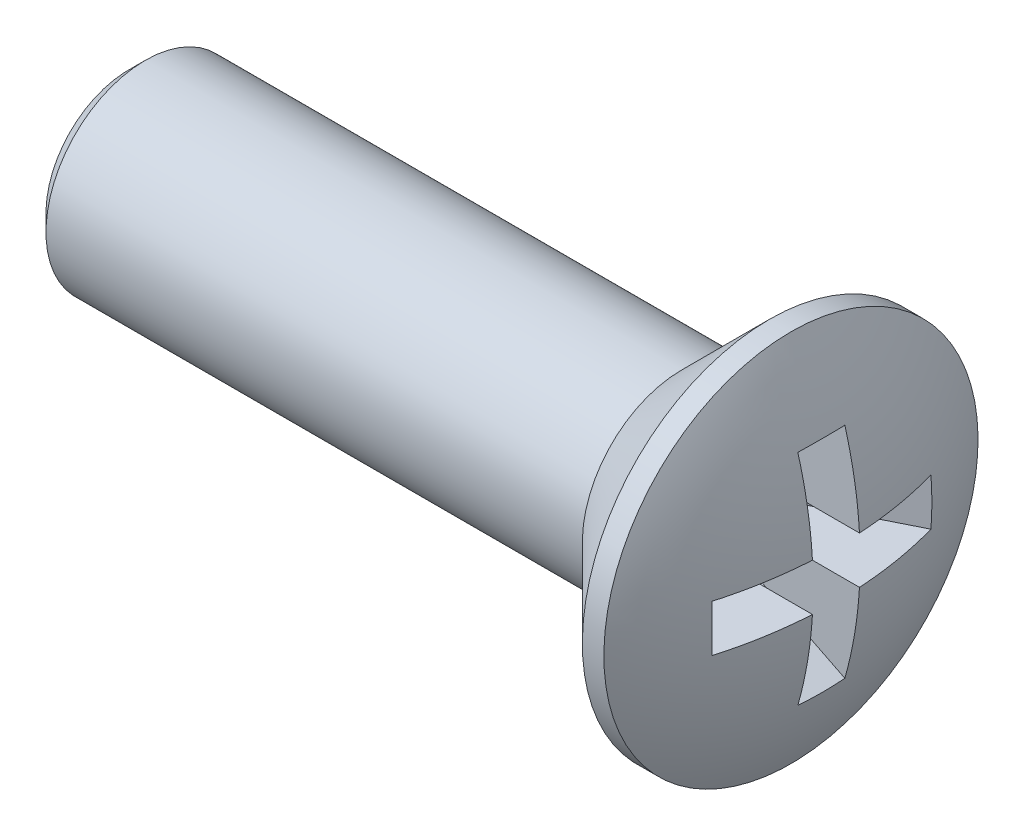
from build123d import *

# Parameters (mm, degrees)
SKETCH2_W          = 1.42
SKETCH2_H          = 2.84
SKETCH2_W_2        = 2.84
SKETCH2_H_2        = 1.42
CUT_EXTRUDE1_DEPTH = 3.85
DRAFT1_ANGLE       = 26.5
CHAMFER1_SIZE      = 0.5


with BuildPart() as part:
    # Sketch1 → Revolve1 (revolve)
    with BuildSketch(Plane.XY):
        with BuildLine():
            Line((-1.4, 5.65), (-2.05, 5.65))
            Line((-2.05, 5.65), (-4.7, 3))
            Line((-4.7, 3), (-21.4, 3))
            Line((-21.4, 3), (-21.4, 0))
            Line((-21.4, 0), (0, 0))
            ThreePointArc((0, 0), (-0.355213526, 2.910433816), (-1.4, 5.65))
        make_face()
    revolve(axis=Axis((0, 0, 0), (-1, 0, 0)))

    # Sketch2 → Cut-Extrude1 (cut)
    with BuildSketch(Plane(origin=(0, 0, 0), x_dir=(0, 0, -1), z_dir=(1, 0, 0))):
        with Locations((0, 2.13)):
            Rectangle(SKETCH2_W, SKETCH2_H)
        with Locations((-2.13, 0)):
            Rectangle(SKETCH2_W_2, SKETCH2_H_2)
        Rectangle(SKETCH2_W, SKETCH2_H_2)
        with Locations((2.13, 0)):
            Rectangle(SKETCH2_W_2, SKETCH2_H_2)
        with Locations((0, -2.13)):
            Rectangle(SKETCH2_W, SKETCH2_H)
    extrude(amount=-CUT_EXTRUDE1_DEPTH, mode=Mode.SUBTRACT)

    # Draft1
    draft1_faces = [part.faces().sort_by_distance(p)[0] for p in [
        (-2.194846815, -3.55, 0),
        (-2.194846815, 0, 3.55),
        (-2.194846815, 0, -3.55),
        (-2.194846815, 3.55, 0),
    ]]
    draft(draft1_faces, Plane(origin=(0, 0, 0), x_dir=(0, 0, 1), z_dir=(1, 0, 0)), DRAFT1_ANGLE)

    # Chamfer1
    chamfer1_edges = [part.edges().sort_by_distance(p)[0] for p in [
        (-21.4, -3, 0),
    ]]
    chamfer(chamfer1_edges, length=CHAMFER1_SIZE)


solid = part.part
